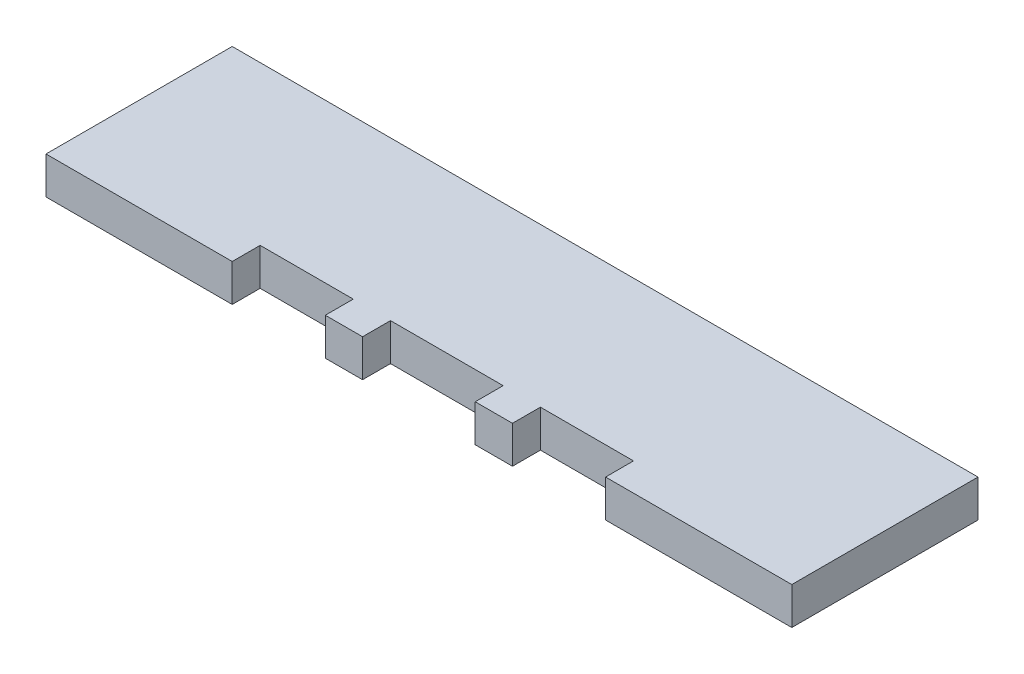
from build123d import *

# Parameters (mm, degrees)
EXTRUDE_1_DEPTH = 4
SKETCH_2_W      = 4
SKETCH_2_H      = 4
EXTRUDE_3_DEPTH = 3


with BuildPart() as part:
    # Эскиз1 → Бобышка-Вытянуть1 (new body)
    with BuildSketch(Plane(origin=(0, 0, 0), x_dir=(1, 0, 0), z_dir=(0, 1, 0))):
        Polygon((0, 0), (0, 3), (40.1, 3), (40.1, 0), (60.1, 0), (60.1, 20), (-20, 20), (-20, 0), align=None)
    extrude(amount=EXTRUDE_1_DEPTH)

    # Эскиз2 → Бобышка-Вытянуть3 (add)
    with BuildSketch(Plane.XY.offset(-3)):
        with Locations((28.1, 2)):
            Rectangle(SKETCH_2_W, SKETCH_2_H)
        with Locations((12, 2)):
            Rectangle(SKETCH_2_W, SKETCH_2_H)
    extrude(amount=EXTRUDE_3_DEPTH)


solid = part.part
